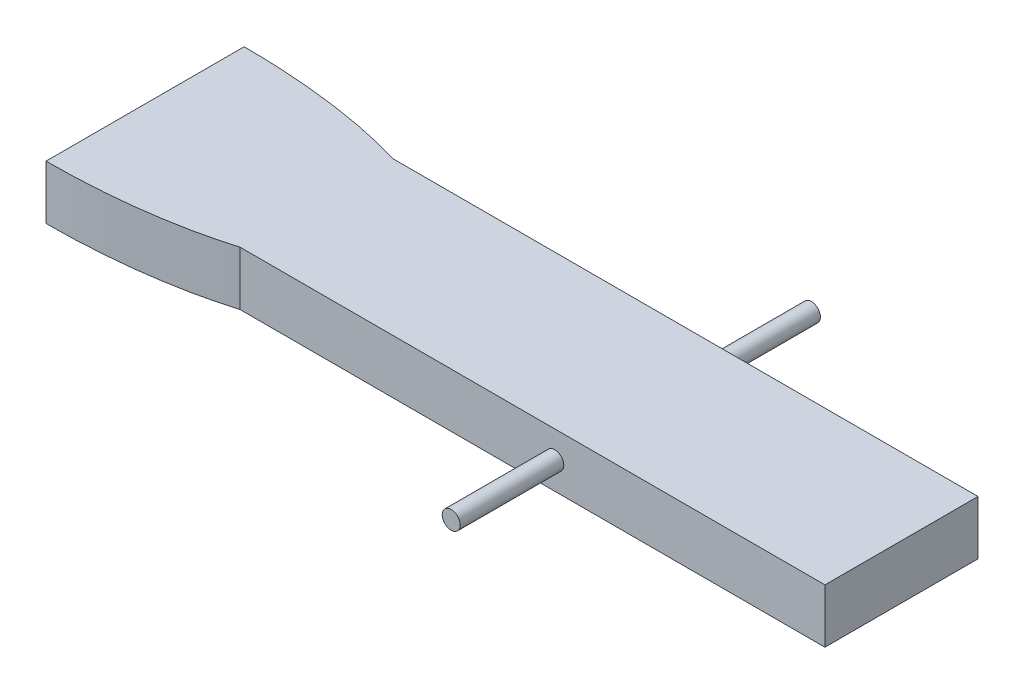
from build123d import *

# Parameters (mm, degrees)
BOSS_EXTRUDE1_DEPTH      = 5.5
BOSS_EXTRUDE1_DEPTH_BACK = 5.5
SKETCH1_W                = 42
SKETCH1_H                = 3
SKETCH2_OUTSIDE_W        = 52.704
SKETCH2_OUTSIDE_H        = 21.704
CUT_EXTRUDE1_DEPTH       = 28.717323103
BOSS_EXTRUDE2_DEPTH      = 10
BOSS_EXTRUDE2_DEPTH_BACK = 10
SKETCH3_R                = 0.5


with BuildPart() as part:
    # Sketch1 → Boss-Extrude1 (new, two sides: drawn at the far end of the back side and taken through both)
    with BuildSketch(Plane.XY.offset(-BOSS_EXTRUDE1_DEPTH_BACK)):
        with Locations((-6, 0)):
            Rectangle(SKETCH1_W, SKETCH1_H)
    extrude(amount=BOSS_EXTRUDE1_DEPTH + BOSS_EXTRUDE1_DEPTH_BACK)

    # Sketch2 outside → Cut-Extrude1 (cut, through all)
    with BuildSketch(Plane(origin=(0, 1.5, 0), x_dir=(1, 0, 0), z_dir=(0, 1, 0))):
        with Locations((-6, 0)):
            Rectangle(SKETCH2_OUTSIDE_W, SKETCH2_OUTSIDE_H)
        with BuildLine():
            Line((15, -4.25), (15, 4.25))
            Line((15, 4.25), (-17.478927243, 4.25))
            add(Edge.make_bspline(
                [(-17.478927243, 4.25), (-21.629138445, 5.5), (-27, 5.5)],
                knots=[0.883126675, 0.883126675, 0.883126675, 1.570796327, 1.570796327, 1.570796327], degree=2, weights=[1, 0.941468872, 1]))
            Line((-27, 5.5), (-27, -5.5))
            add(Edge.make_bspline(
                [(-27, -5.5), (-21.629138445, -5.5), (-17.478927243, -4.25)],
                knots=[4.71238898, 4.71238898, 4.71238898, 5.400058632, 5.400058632, 5.400058632], degree=2, weights=[1, 0.941468872, 1]))
            Line((-17.478927243, -4.25), (15, -4.25))
        make_face(mode=Mode.SUBTRACT)
    extrude(amount=-CUT_EXTRUDE1_DEPTH, mode=Mode.SUBTRACT)

    # Sketch3 → Boss-Extrude2 (add, two sides: drawn at the far end of the back side and taken through both)
    with BuildSketch(Plane.XY.offset(-BOSS_EXTRUDE2_DEPTH_BACK)):
        Circle(SKETCH3_R)
    extrude(amount=BOSS_EXTRUDE2_DEPTH + BOSS_EXTRUDE2_DEPTH_BACK)


solid = part.part
